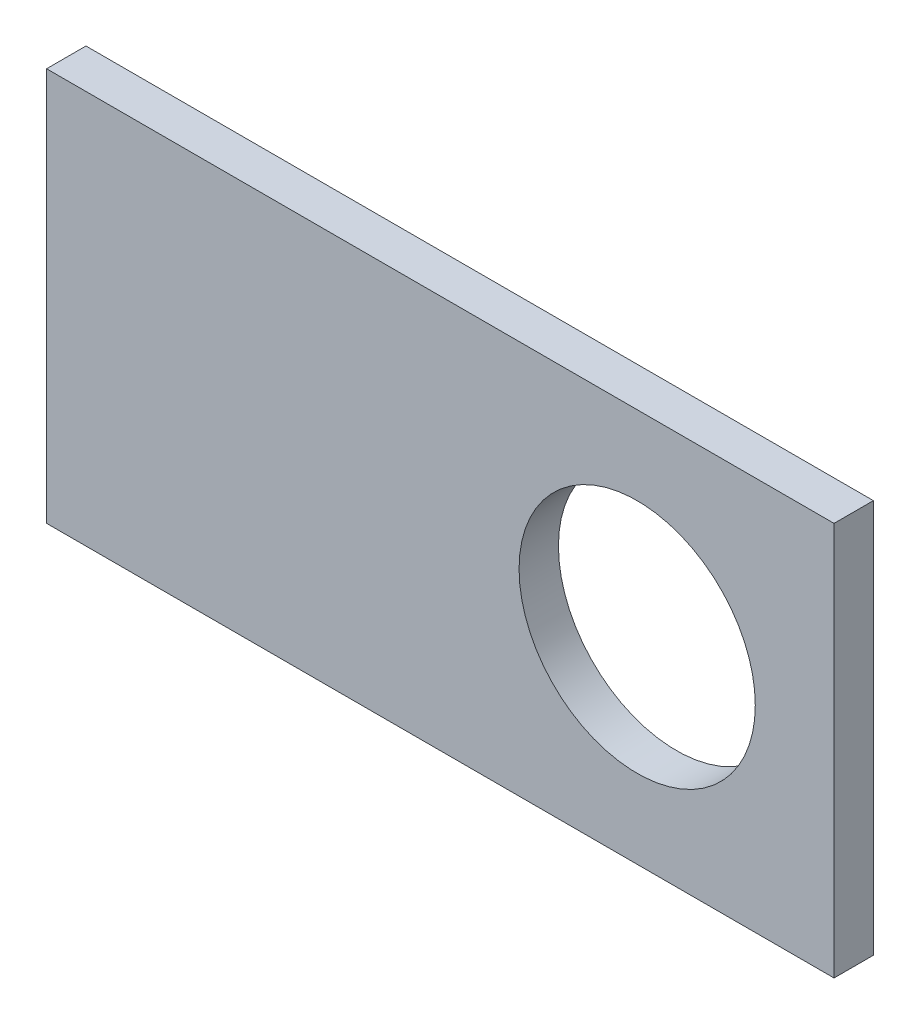
from build123d import *

# Parameters (mm, degrees)
SKETCH1_W           = 10000
SKETCH1_H           = 5000
SKETCH1_R           = 1500
BOSS_EXTRUDE1_DEPTH = 500


with BuildPart() as part:
    # Sketch1 → Boss-Extrude1 (new body)
    with BuildSketch(Plane.XY):
        with Locations((5000, 2500)):
            Rectangle(SKETCH1_W, SKETCH1_H)
        with Locations((7500, 2500)):
            Circle(SKETCH1_R, mode=Mode.SUBTRACT)
    extrude(amount=BOSS_EXTRUDE1_DEPTH)


solid = part.part
